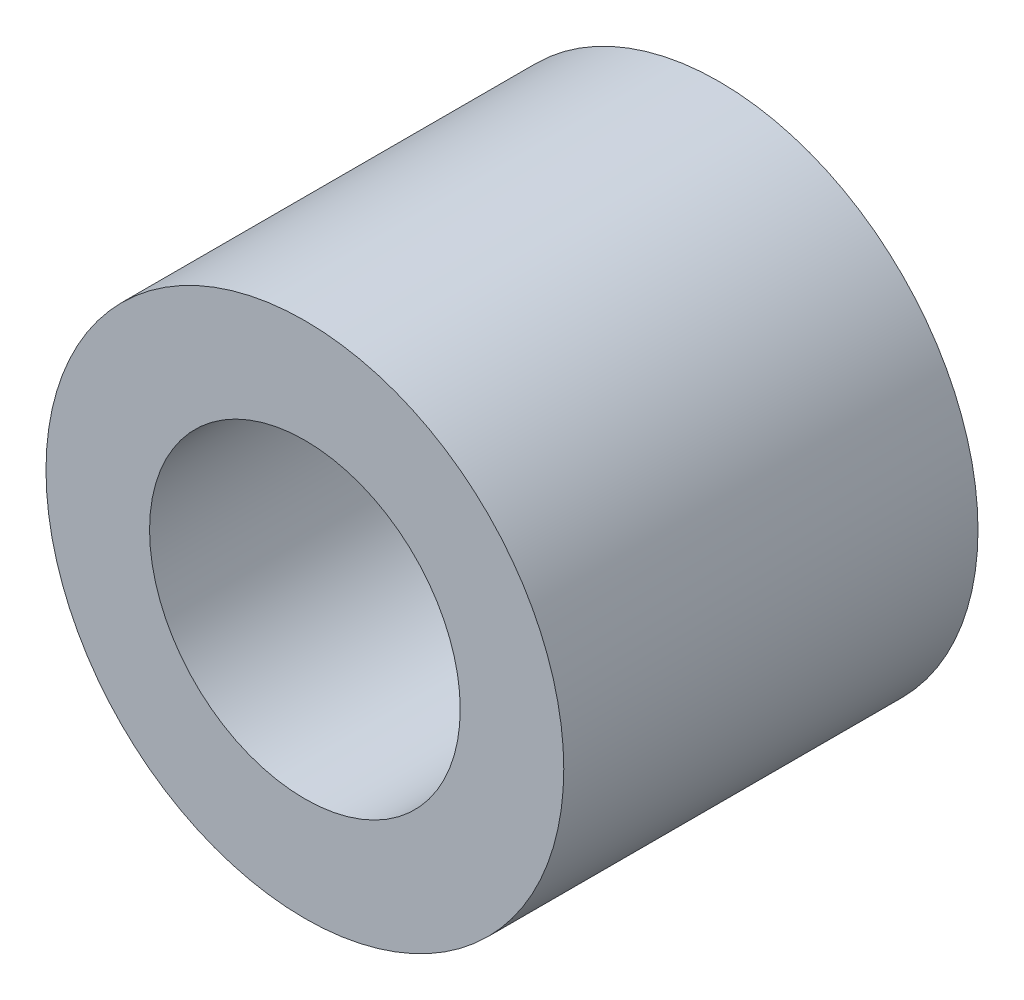
from build123d import *

# Parameters (mm, degrees)
SKETCH_1_R      = 2.5
SKETCH_1_R_2    = 1.5
EXTRUDE_1_DEPTH = 4
SCALE_1_SCALE   = 0.6


with BuildPart() as part:
    # 草图1 → 凸台-拉伸1 (new body)
    with BuildSketch(Plane.XY):
        Circle(SKETCH_1_R)
        Circle(SKETCH_1_R_2, mode=Mode.SUBTRACT)
    extrude(amount=EXTRUDE_1_DEPTH)


with BuildPart() as part_1:
    # 缩放比例1: scaled about (0, 0, 0)
    add(part.part.scale(SCALE_1_SCALE))


solid = part_1.part
